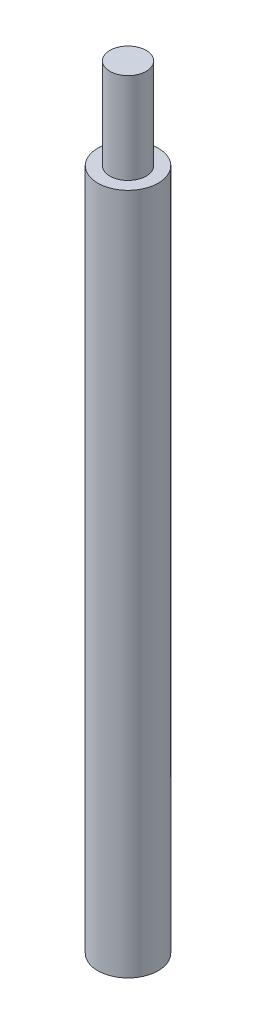
from build123d import *

# Parameters (mm, degrees)
SKETCH1_R           = 10
BOSS_EXTRUDE1_DEPTH = 225.425
SKETCH2_R           = 6
BOSS_EXTRUDE2_DEPTH = 30


with BuildPart() as part:
    # Sketch1 → Boss-Extrude1 (new body)
    with BuildSketch(Plane(origin=(0, 0, 0), x_dir=(1, 0, 0), z_dir=(0, 1, 0))):
        with Locations(Location((0, 0, 0), (0, 0, 90))):
            Circle(SKETCH1_R)
    extrude(amount=BOSS_EXTRUDE1_DEPTH)

    # Sketch2 → Boss-Extrude2 (add)
    with BuildSketch(Plane(origin=(0, 225.425, 0), x_dir=(1, 0, 0), z_dir=(0, 1, 0))):
        with Locations(Location((0, 0, 0), (0, 0, 270))):
            Circle(SKETCH2_R)
    extrude(amount=BOSS_EXTRUDE2_DEPTH)


solid = part.part
